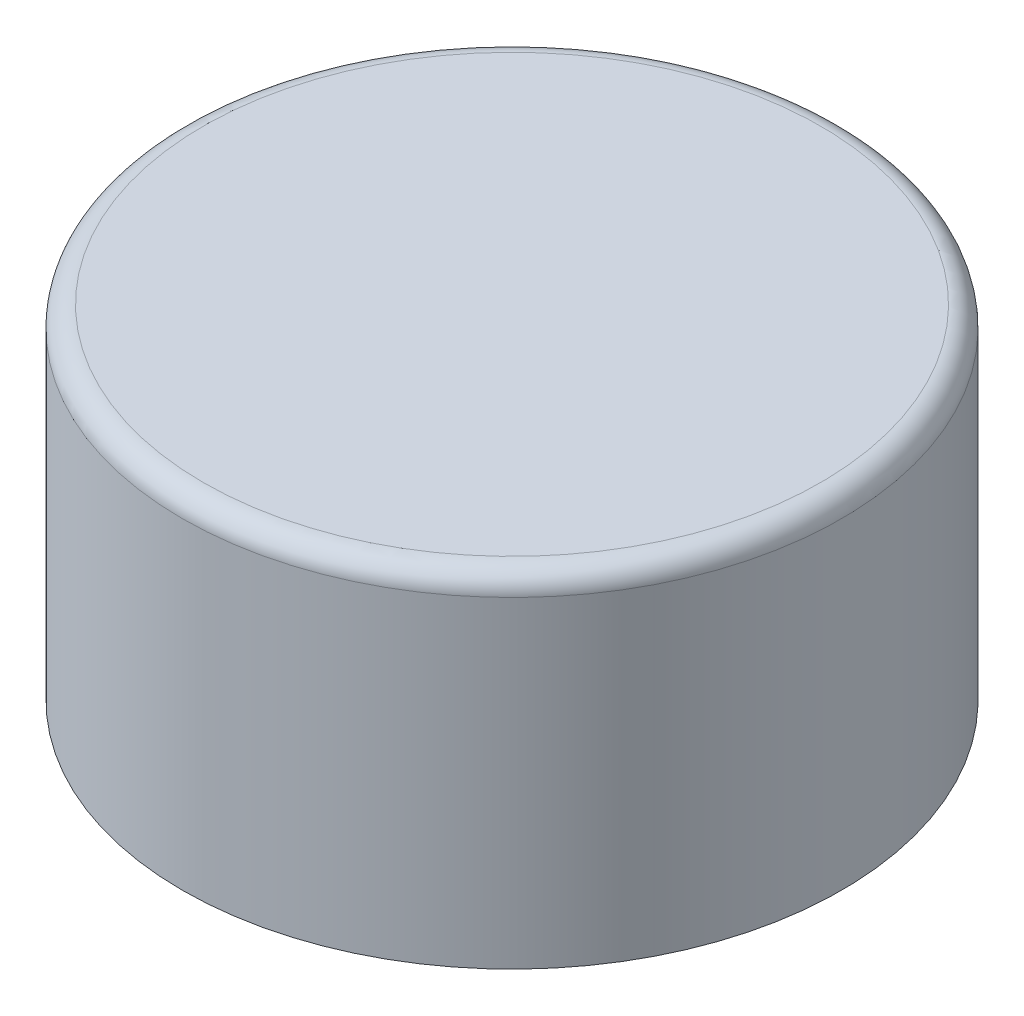
from build123d import *

# Parameters (mm, degrees)
SKETCH1_R           = 7.493
BOSS_EXTRUDE1_DEPTH = 7.2644
SKETCH2_R           = 20.0533
BOSS_EXTRUDE2_DEPTH = 20.8534
FILLET1_R           = 1.27


with BuildPart() as part:
    # Sketch1 → Boss-Extrude1 (new body)
    with BuildSketch(Plane(origin=(0, 0, 0), x_dir=(1, 0, 0), z_dir=(0, 1, 0))):
        with Locations(Location((0, 0, 0), (0, 0, 270))):
            Circle(SKETCH1_R)
    extrude(amount=BOSS_EXTRUDE1_DEPTH)

    # Sketch2 → Boss-Extrude2 (add)
    with BuildSketch(Plane(origin=(0, 7.2644, 0), x_dir=(1, 0, 0), z_dir=(0, 1, 0))):
        with Locations(Location((0, 0, 0), (0, 0, 270))):
            Circle(SKETCH2_R)
    extrude(amount=BOSS_EXTRUDE2_DEPTH)

    # Fillet1
    fillet1_edges = [part.edges().sort_by_distance(p)[0] for p in [
        (0, 28.1178, -20.0533),
    ]]
    fillet(fillet1_edges, radius=FILLET1_R)


solid = part.part
